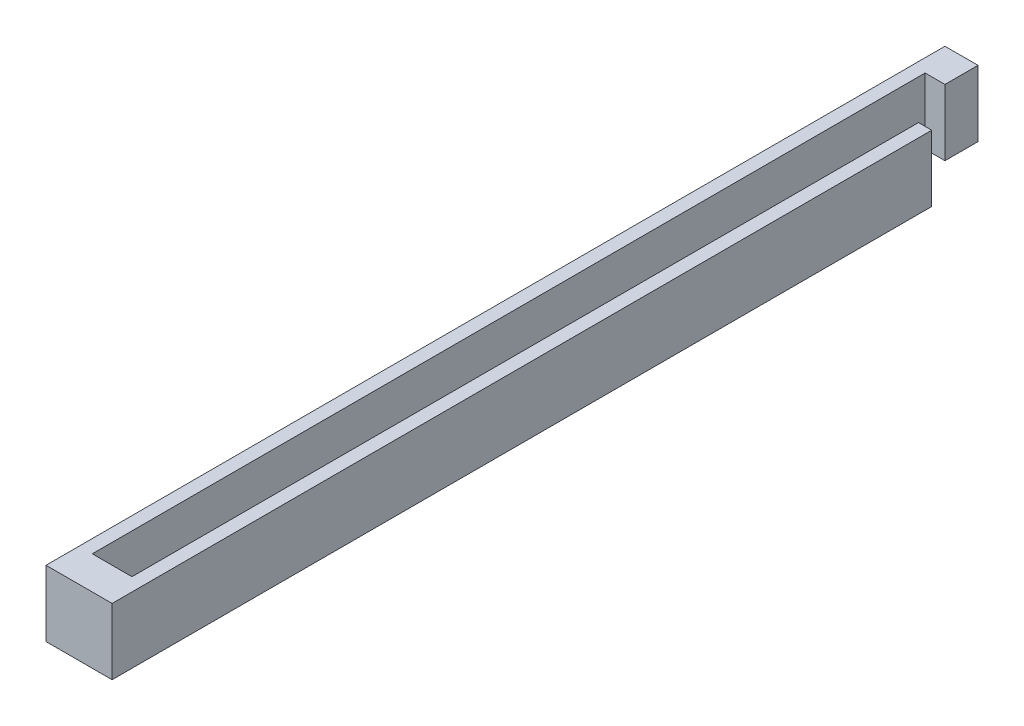
from build123d import *

# Parameters (mm, degrees)
SKETCH1_W           = 10
SKETCH1_H           = 136
BOSS_EXTRUDE1_DEPTH = 10
CUT_EXTRUDE1_DEPTH  = 10
SKETCH4_W           = 2
SKETCH4_H           = 12
CUT_EXTRUDE3_DEPTH  = 10


with BuildPart() as part:
    # Sketch1 → Boss-Extrude1 (new body)
    with BuildSketch(Plane(origin=(0, 0, 0), x_dir=(1, 0, 0), z_dir=(0, 1, 0))):
        Rectangle(SKETCH1_W, SKETCH1_H)
    extrude(amount=BOSS_EXTRUDE1_DEPTH)

    # Sketch2 → Cut-Extrude1 (cut)
    with BuildSketch(Plane(origin=(0, 0, 0), x_dir=(1, 0, 0), z_dir=(0, 1, 0))):
        Polygon((0, -63), (-3, -63), (-3, 63), (0, 63), (0, 68), (3, 68), (3, 63), (3, -63), align=None)
    extrude(amount=CUT_EXTRUDE1_DEPTH, mode=Mode.SUBTRACT)

    # Sketch4 → Cut-Extrude3 (cut)
    with BuildSketch(Plane(origin=(0, 10, 0), x_dir=(1, 0, 0), z_dir=(0, 1, 0))):
        with Locations((4, 62)):
            Rectangle(SKETCH4_W, SKETCH4_H)
    extrude(amount=-CUT_EXTRUDE3_DEPTH, mode=Mode.SUBTRACT)


solid = part.part
